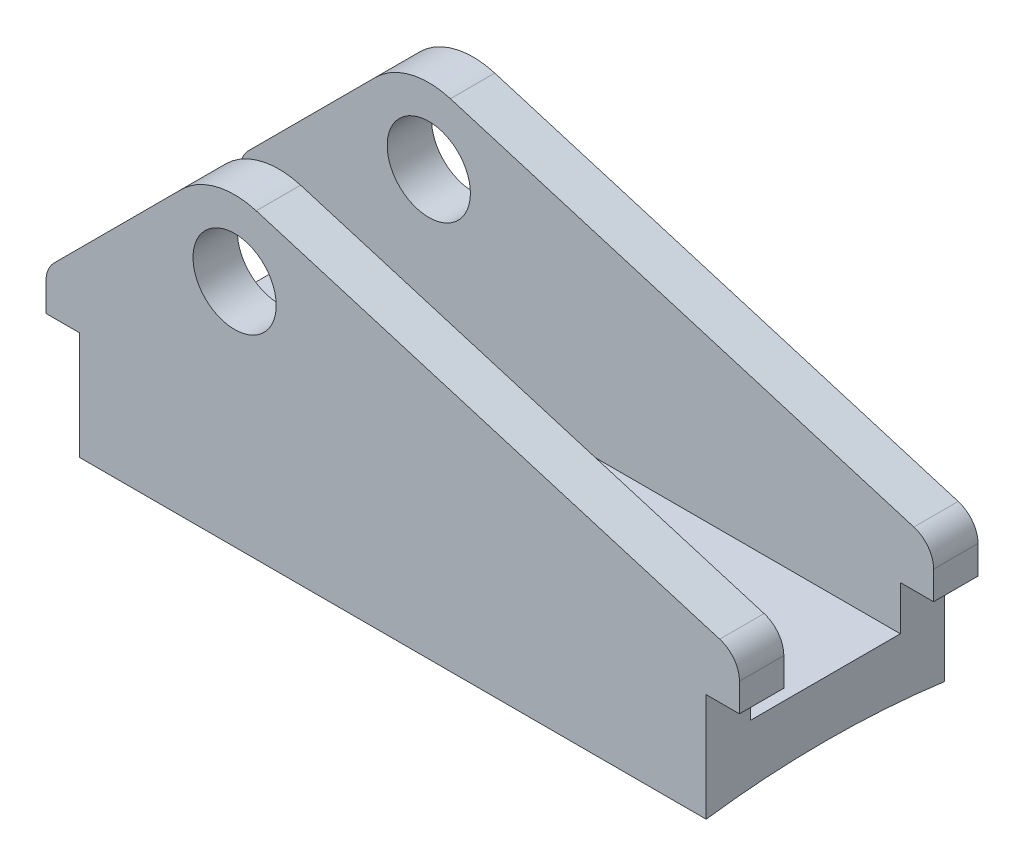
from build123d import *

# Parameters (mm, degrees)
SKETCH3_W           = 113
SKETCH3_H           = 43
BOSS_EXTRUDE1_DEPTH = 10
SKETCH5_R           = 7.5
BOSS_EXTRUDE3_DEPTH = 8
CUT_EXTRUDE5_DEPTH  = 133.252986734


with BuildPart() as part:
    # Sketch3 → Boss-Extrude1 (new, symmetric)
    with BuildSketch(Plane(origin=(0, 0, 0), x_dir=(1, 0, 0), z_dir=(0, 1, 0))):
        Rectangle(SKETCH3_W, SKETCH3_H)
    extrude(amount=BOSS_EXTRUDE1_DEPTH, both=True)

    # Sketch5 → Boss-Extrude3 (add)
    with BuildSketch(Plane.XY.offset(21.5)):
        with BuildLine():
            Line((56.5, 0), (-56.5, 0))
            Line((-56.5, 0), (-56.5, 18))
            Line((-56.5, 18), (-62.5, 18))
            Line((-62.5, 18), (-62.5, 23.091525958))
            ThreePointArc((-62.5, 23.091525958), (-62.119397663, 25.00494312), (-61.035533906, 26.627059864))
            Line((-61.035533906, 26.627059864), (-38.081296885, 49.581296885))
            ThreePointArc((-38.081296885, 49.581296885), (-31.81001697, 53.139493432), (-24.601457677, 52.977051582))
            Line((-24.601457677, 52.977051582), (58.938576503, 27.880105878))
            ThreePointArc((58.938576503, 27.880105878), (61.512037046, 26.075409123), (62.5, 23.091525958))
            Line((62.5, 23.091525958), (62.5, 18))
            Line((62.5, 18), (56.5, 18))
            Line((56.5, 18), (56.5, 0))
        make_face()
        with Locations((-28.5, 40)):
            Circle(SKETCH5_R, mode=Mode.SUBTRACT)
    boss_extrude3 = extrude(amount=-BOSS_EXTRUDE3_DEPTH)

    # Mirror1: Boss-Extrude3 across plane
    add(boss_extrude3.mirror(Plane.XY))

    # Sketch4 → Cut-Extrude5 (cut, through all)
    with BuildSketch(Plane(origin=(56.5, 0, 0), x_dir=(0, 0, -1), z_dir=(1, 0, 0))):
        with BuildLine():
            ThreePointArc((21.5, -1.451111641), (0, 0), (-21.5, -1.451111641))
            Line((-21.5, -1.451111641), (-21.5, -10))
            Line((-21.5, -10), (21.5, -10))
            Line((21.5, -10), (21.5, -1.451111641))
        make_face()
        with BuildLine():
            Line((-21.5, -10), (-21.5, -1.451111641))
            ThreePointArc((-21.5, -1.451111641), (-105.261578936, -280.498962651), (160, -160))
            ThreePointArc((160, -160), (120.498962651, -54.738421064), (21.5, -1.451111641))
            Line((21.5, -1.451111641), (21.5, -10))
            Line((21.5, -10), (-21.5, -10))
        make_face()
    extrude(amount=-CUT_EXTRUDE5_DEPTH, mode=Mode.SUBTRACT)


solid = part.part
